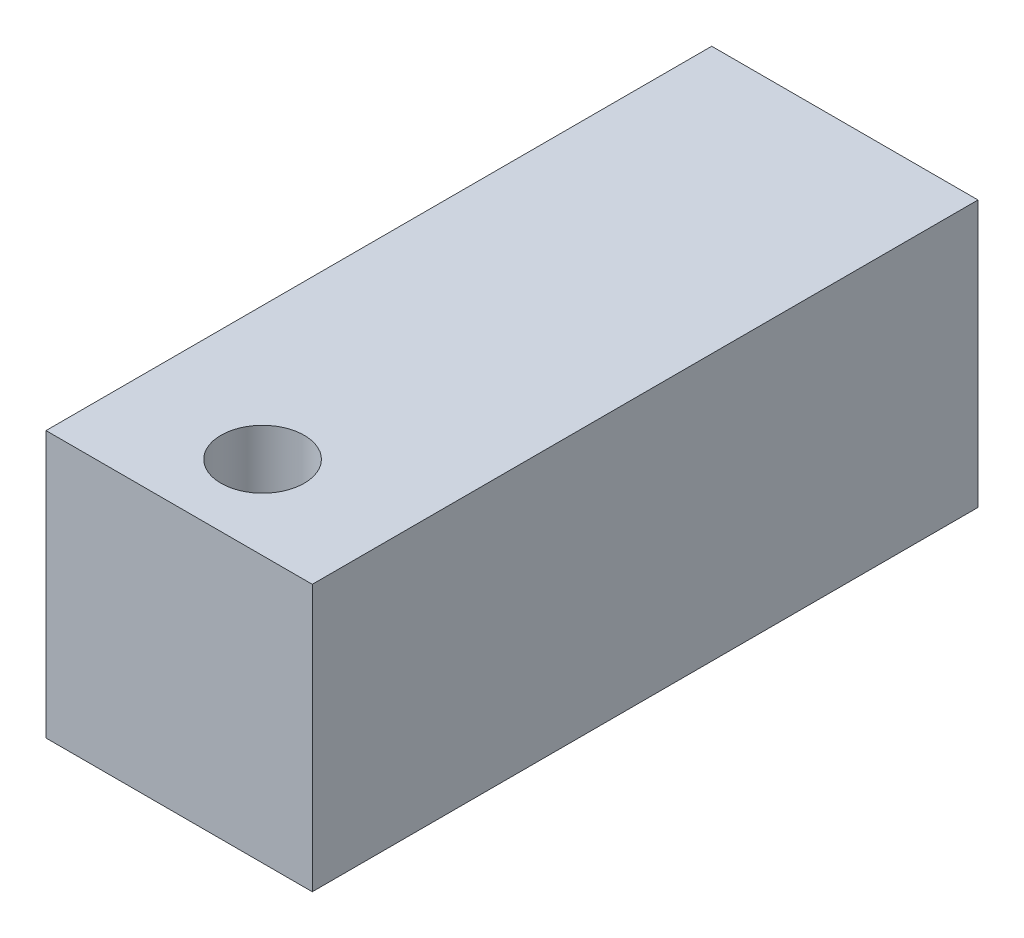
from build123d import *

# Parameters (mm, degrees)
SKETCH1_W             = 3.81
SKETCH1_H             = 9.525
BOSS_EXTRUDE1_DEPTH   = 3.81
F_0_80_TAPPED_HOLE1_D = 1.19126


with BuildPart() as part:
    # Sketch1 → Boss-Extrude1 (new body)
    with BuildSketch(Plane(origin=(0, 0, 0), x_dir=(1, 0, 0), z_dir=(0, 1, 0))):
        Rectangle(SKETCH1_W, SKETCH1_H)
    extrude(amount=BOSS_EXTRUDE1_DEPTH)

    # #0-80 Tapped Hole1 (through all)
    with Locations(Plane(origin=(0, 3.81, 0), x_dir=(1, 0, 0), z_dir=(0, 1, 0))):
        with Locations((0, -3.5687)):
            Hole(F_0_80_TAPPED_HOLE1_D / 2)


solid = part.part
